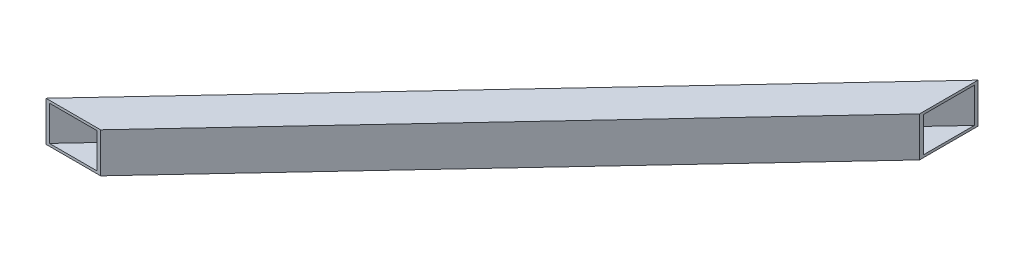
from build123d import *

# Parameters (mm, degrees)
BOSS_EXTRUDE2_DEPTH = 9.525
CUT_EXTRUDE1_DEPTH  = 8.325


with BuildPart() as part:
    # Sketch1 → Boss-Extrude2 (new, symmetric)
    with BuildSketch(Plane(origin=(0, 0, 0), x_dir=(1, 0, 0), z_dir=(0, 1, 0))):
        Polygon((-114.01926677, -108.025900665), (-87.942199691, -108.025900665), (100.98073323, 94.077701995), (100.98073323, 121.974099335), align=None)
    extrude(amount=BOSS_EXTRUDE2_DEPTH, both=True)

    # Sketch4 → Cut-Extrude1 (cut, symmetric)
    with BuildSketch(Plane(origin=(0, 0, 0), x_dir=(1, 0, 0), z_dir=(0, 1, 0))):
        Polygon((100.98073323, 95.83495537), (100.98073323, 120.216845959), (-112.376616875, -108.025900665), (-89.584849585, -108.025900665), align=None)
    extrude(amount=CUT_EXTRUDE1_DEPTH, both=True, mode=Mode.SUBTRACT)


solid = part.part
